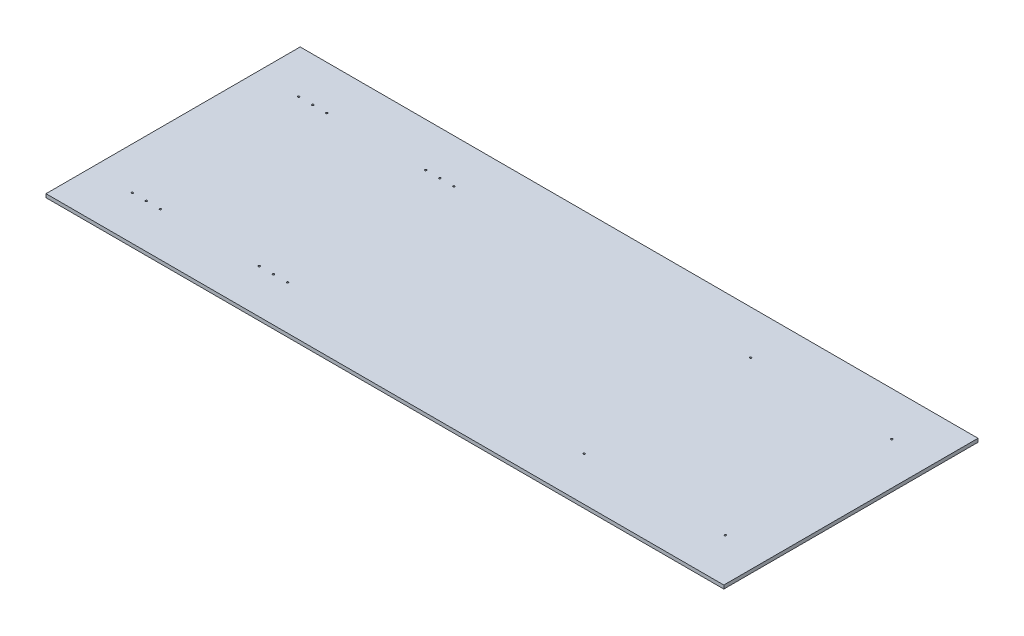
from build123d import *

# Parameters (mm, degrees)
SKETCH1_W                                      = 1219.2
SKETCH1_H                                      = 457.2
BOSS_EXTRUDE1_DEPTH                            = 6.35
CSK_FOR_4_FLAT_HEAD_MACHINE_SCREW1_D           = 3.2639
CSK_FOR_4_FLAT_HEAD_MACHINE_SCREW1_CSINK_D     = 5.715
CSK_FOR_4_FLAT_HEAD_MACHINE_SCREW1_CSINK_ANGLE = 82
CSK_FOR_4_FLAT_HEAD_MACHINE_SCREW2_D           = 3.2639
CSK_FOR_4_FLAT_HEAD_MACHINE_SCREW2_CSINK_D     = 5.715
CSK_FOR_4_FLAT_HEAD_MACHINE_SCREW2_CSINK_ANGLE = 82


with BuildPart() as part:
    # Sketch1 → Boss-Extrude1 (new body)
    with BuildSketch(Plane(origin=(0, 0, 0), x_dir=(1, 0, 0), z_dir=(0, 1, 0))):
        with Locations((539.930699859, 202.710979244)):
            Rectangle(SKETCH1_W, SKETCH1_H)
    extrude(amount=BOSS_EXTRUDE1_DEPTH)

    # CSK for #4 Flat Head Machine Screw1 (through all)
    with Locations(Plane(origin=(1073.330699859, 0, -53.054179244), x_dir=(0, 0, -1), z_dir=(0, -1, 0))):
        with Locations((0, 0), (299.3136, 0), (299.3136, -253.938936661), (0, -253.938936661), (0, -1066.8), (0, -838.266153012), (299.3136, -838.266153012), (299.3136, -1066.8)):
            CounterSinkHole(CSK_FOR_4_FLAT_HEAD_MACHINE_SCREW1_D / 2, CSK_FOR_4_FLAT_HEAD_MACHINE_SCREW1_CSINK_D / 2, counter_sink_angle=CSK_FOR_4_FLAT_HEAD_MACHINE_SCREW1_CSINK_ANGLE)

    # CSK for #4 Flat Head Machine Screw2 (through all)
    with Locations(Plane(origin=(31.930699859, 0, -53.054179244), x_dir=(0, 0, -1), z_dir=(0, -1, 0))):
        with Locations((0, 0), (0, 25.4), (0, 228.533846988), (0, 253.933846988), (299.3136, 228.533846988), (299.3136, 253.933846988), (299.3136, 0), (299.3136, 25.4)):
            CounterSinkHole(CSK_FOR_4_FLAT_HEAD_MACHINE_SCREW2_D / 2, CSK_FOR_4_FLAT_HEAD_MACHINE_SCREW2_CSINK_D / 2, counter_sink_angle=CSK_FOR_4_FLAT_HEAD_MACHINE_SCREW2_CSINK_ANGLE)


solid = part.part
